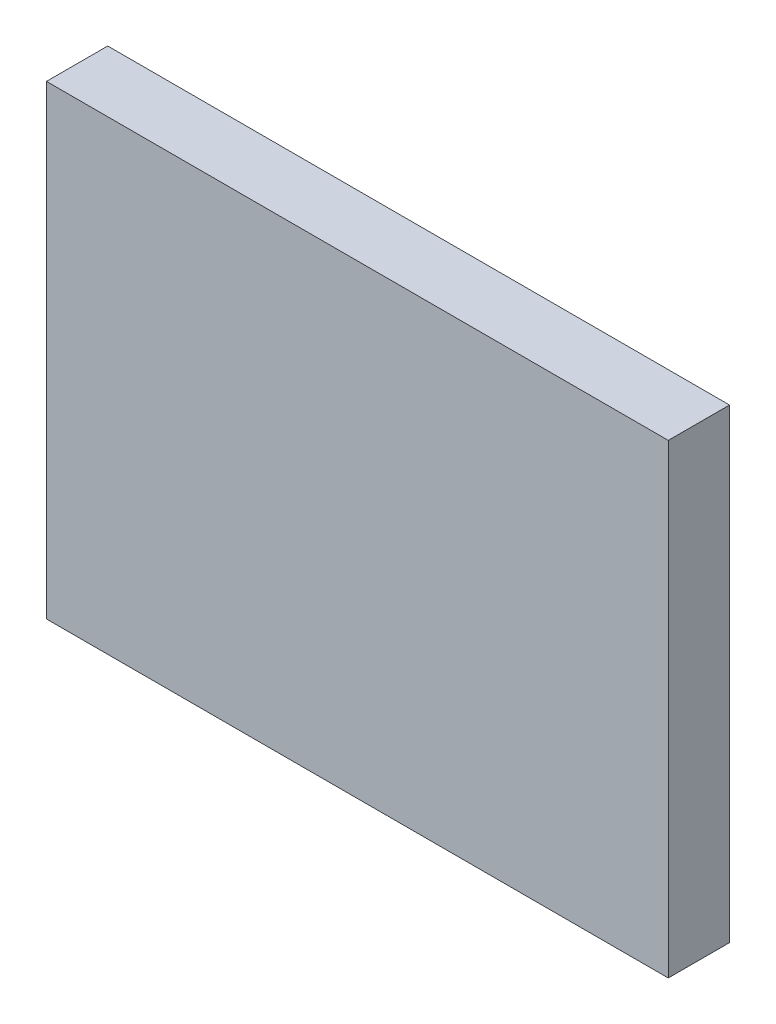
from build123d import *

# Parameters (mm, degrees)
ESQUISSE1_W        = 20.3
ESQUISSE1_H        = 15.2
BOSS_EXTRU_1_DEPTH = 2


with BuildPart() as part:
    # Esquisse1 → Boss.-Extru.1 (new body)
    with BuildSketch(Plane.XY):
        with Locations((-0.035281742, 5.34775641)):
            Rectangle(ESQUISSE1_W, ESQUISSE1_H)
    extrude(amount=BOSS_EXTRU_1_DEPTH)


solid = part.part
